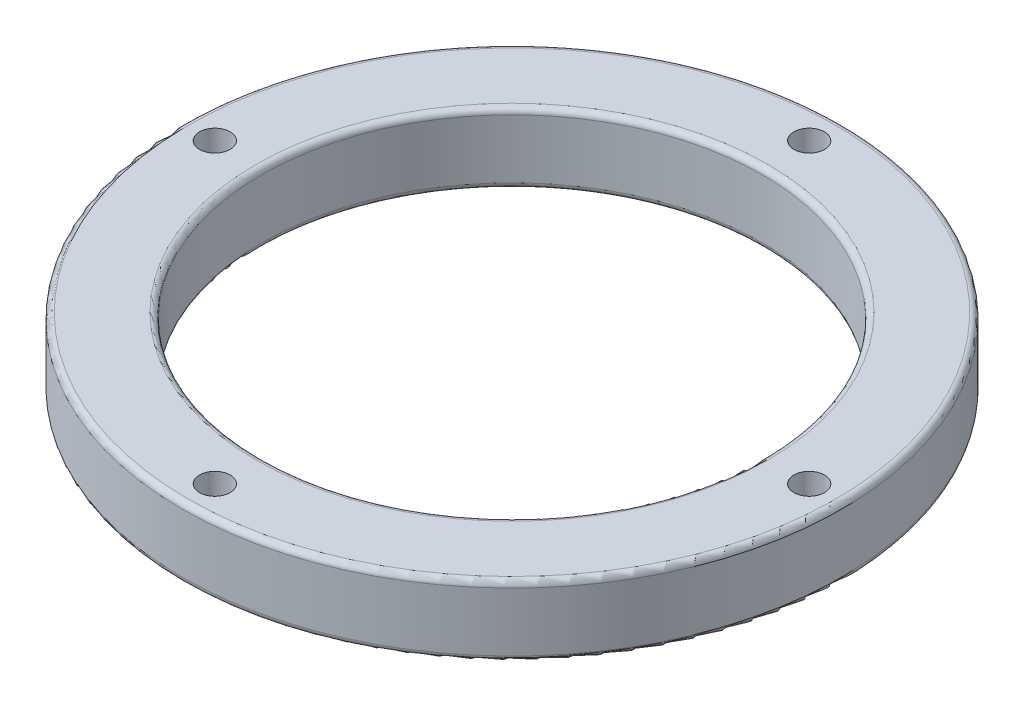
from build123d import *

# Parameters (mm, degrees)
SKETCH_3_R      = 56
SKETCH_3_R_2    = 42.5
SKETCH_3_R_3    = 2.6
EXTRUDE_1_DEPTH = 12
FILLET_1_R      = 1


with BuildPart() as part:
    # 草图3 → 凸台-拉伸1 (new body)
    with BuildSketch(Plane(origin=(0, 0, 0), x_dir=(1, 0, 0), z_dir=(0, 1, 0))):
        with Locations(Location((0, 0, 0), (0, 0, 270))):
            Circle(SKETCH_3_R)
        with Locations(Location((0, 0, 0), (0, 0, 270))):
            Circle(SKETCH_3_R_2, mode=Mode.SUBTRACT)
        with Locations(Location((50.5, 0, 0), (0, 0, 270))):
            Circle(SKETCH_3_R_3, mode=Mode.SUBTRACT)
        with Locations(Location((0, -50.5, 0), (0, 0, 270))):
            Circle(SKETCH_3_R_3, mode=Mode.SUBTRACT)
        with Locations(Location((-50.5, 0, 0), (0, 0, 270))):
            Circle(SKETCH_3_R_3, mode=Mode.SUBTRACT)
        with Locations(Location((0, 50.5, 0), (0, 0, 270))):
            Circle(SKETCH_3_R_3, mode=Mode.SUBTRACT)
    extrude(amount=EXTRUDE_1_DEPTH)

    # 圆角1
    fillet_1_edges = [part.edges().sort_by_distance(p)[0] for p in [
        (0, 0, -56),
        (0, 12, -56),
        (0, 0, -42.5),
        (0, 12, -42.5),
    ]]
    fillet(fillet_1_edges, radius=FILLET_1_R)


solid = part.part
